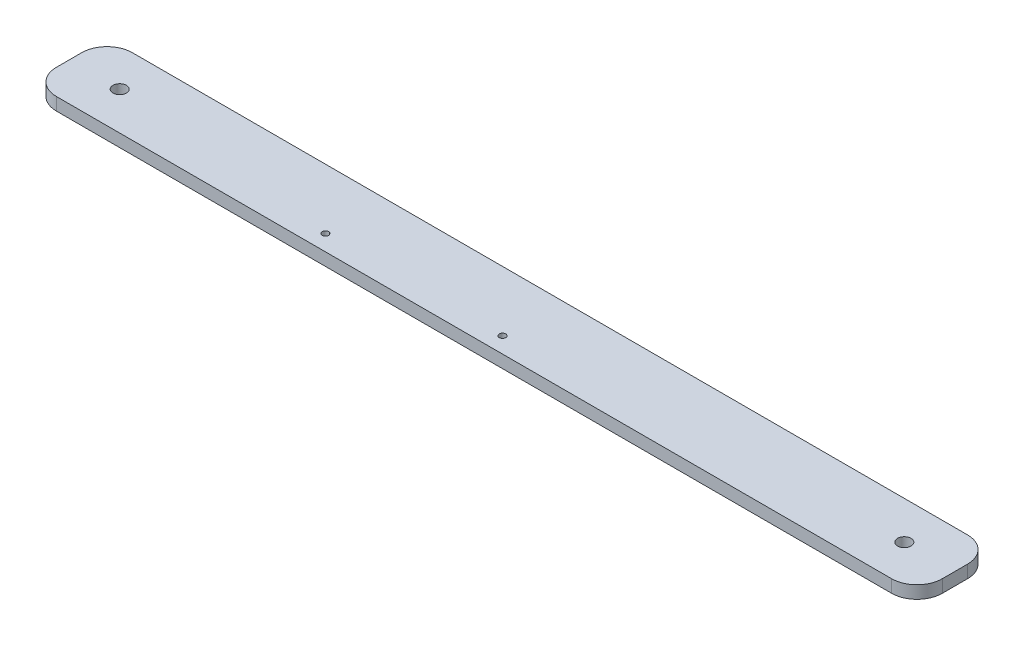
from build123d import *

# Parameters (mm, degrees)
SKETCH1_W                                      = 444.5
SKETCH1_H                                      = 38.1
BOSS_EXTRUDE1_DEPTH                            = 6.35
FILLET1_R                                      = 12.7
FILLET2_R                                      = 12.7
FILLET3_R                                      = 12.7
FILLET4_R                                      = 12.7
SKETCH2_R                                      = 3.3782
CUT_EXTRUDE1_DEPTH                             = 447.175058133
SKETCH4_R                                      = 3.3782
CUT_EXTRUDE2_DEPTH                             = 447.175058133
CSK_FOR_4_FLAT_HEAD_MACHINE_SCREW1_D           = 3.2639
CSK_FOR_4_FLAT_HEAD_MACHINE_SCREW1_CSINK_D     = 5.715
CSK_FOR_4_FLAT_HEAD_MACHINE_SCREW1_CSINK_ANGLE = 82


with BuildPart() as part:
    # Sketch1 → Boss-Extrude1 (new body)
    with BuildSketch(Plane(origin=(0, 0, 0), x_dir=(1, 0, 0), z_dir=(0, 1, 0))):
        with Locations((222.25, 19.05)):
            Rectangle(SKETCH1_W, SKETCH1_H)
    extrude(amount=BOSS_EXTRUDE1_DEPTH)

    # Fillet1
    fillet1_edges = [part.edges().sort_by_distance(p)[0] for p in [
        (0, 3.175, 0),
    ]]
    fillet(fillet1_edges, radius=FILLET1_R)

    # Fillet2
    fillet2_edges = [part.edges().sort_by_distance(p)[0] for p in [
        (0, 3.175, -38.1),
    ]]
    fillet(fillet2_edges, radius=FILLET2_R)

    # Fillet3
    fillet3_edges = [part.edges().sort_by_distance(p)[0] for p in [
        (444.5, 3.175, -38.1),
    ]]
    fillet(fillet3_edges, radius=FILLET3_R)

    # Fillet4
    fillet4_edges = [part.edges().sort_by_distance(p)[0] for p in [
        (444.5, 3.175, 0),
    ]]
    fillet(fillet4_edges, radius=FILLET4_R)

    # Sketch2 → Cut-Extrude1 (cut, through all)
    with BuildSketch(Plane(origin=(0, 6.35, 0), x_dir=(1, 0, 0), z_dir=(0, 1, 0))):
        with Locations(Location((25.4, 19.05, 0), (0, 0, 270))):
            Circle(SKETCH2_R)
    extrude(amount=-CUT_EXTRUDE1_DEPTH, mode=Mode.SUBTRACT)

    # Sketch4 → Cut-Extrude2 (cut, through all)
    with BuildSketch(Plane(origin=(0, 6.35, 0), x_dir=(1, 0, 0), z_dir=(0, 1, 0))):
        with Locations(Location((419.1, 19.05, 0), (0, 0, 270))):
            Circle(SKETCH4_R)
    extrude(amount=-CUT_EXTRUDE2_DEPTH, mode=Mode.SUBTRACT)

    # CSK for #4 Flat Head Machine Screw1 (through all)
    with Locations(Plane(origin=(0, 0, 0), x_dir=(-1, 0, 0), z_dir=(0, -1, 0))):
        with Locations((-228.6, 7.9375), (-139.7, 7.9375)):
            CounterSinkHole(CSK_FOR_4_FLAT_HEAD_MACHINE_SCREW1_D / 2, CSK_FOR_4_FLAT_HEAD_MACHINE_SCREW1_CSINK_D / 2, counter_sink_angle=CSK_FOR_4_FLAT_HEAD_MACHINE_SCREW1_CSINK_ANGLE)


solid = part.part
